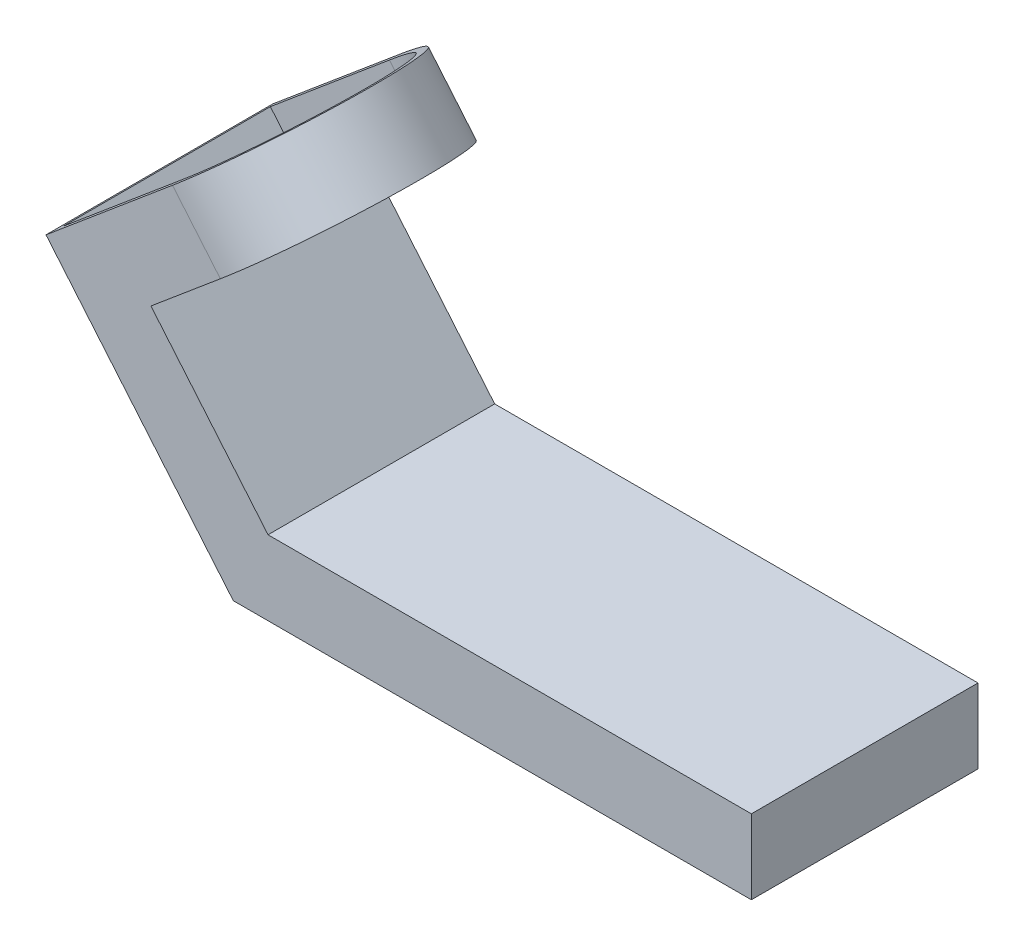
from build123d import *

# Parameters (mm, degrees)
BOSS_EXTRU_1_DEPTH      = 70
BOSS_EXTRU_2_DEPTH      = 23
ENL_V_MAT_EXTRU_1_REACH = 240.982
ESQUISSE3_R             = 9.500000000000002
COQUE1_T                = -3


with BuildPart() as part:
    # Esquisse1 → Boss.-Extru.1 (new body)
    with BuildSketch(Plane.XY):
        Polygon((0, 0), (-57.85088487178843, 68.94399988070812), (-18.782618272720498, 101.72616797472158), (-3.9985032499301187, 84.10714578298506), (-25.447747657261537, 66.10909271176199), (10.725076137565006, 23.000000000000007), (160, 23.000000000000004), (160, 2.45e-15), align=None)
    extrude(amount=-BOSS_EXTRU_1_DEPTH)

    # Esquisse2 → Boss.-Extru.2 (add)
    with BuildSketch(Plane(origin=(-57.85088487178846, 68.94399988070815, 0), x_dir=(0.7660444431189791, 0.6427876096865383, 0), z_dir=(-0.6427876096865383, 0.7660444431189791, 0))):
        with BuildLine():
            Line((51.00000000000002, 70), (50.99999999999999, 0))
            ThreePointArc((50.99999999999999, 0), (86.00000000000003, 34.999999999999986), (51.00000000000002, 70))
        make_face()
    extrude(amount=-BOSS_EXTRU_2_DEPTH)

    # Esquisse3 → Enlèv. mat.-Extru.1 (cut, up to next)
    with BuildSketch(Plane(origin=(-57.85088487178846, 68.94399988070815, 0), x_dir=(0.7660444431189791, 0.6427876096865383, 0), z_dir=(-0.6427876096865383, 0.7660444431189791, 0)), mode=Mode.PRIVATE) as enl_v_mat_extru_1_sk1:
        with Locations(Location((51.000000000000036, 35, 0), (0, 0, 180))):
            Circle(ESQUISSE3_R)
    enl_v_mat_extru_1_tool1 = extrude(enl_v_mat_extru_1_sk1.sketch, amount=-ENL_V_MAT_EXTRU_1_REACH, mode=Mode.PRIVATE) & part.part
    add(enl_v_mat_extru_1_tool1.solids().sort_by_distance((-18.782618, 101.726168, -35))[0], mode=Mode.SUBTRACT)

    # Coque1
    coque1_openings = [part.faces().sort_by_distance(p)[0] for p in [
        (-27.96387644, 94.022177633, -35),
        (-4.113138552, 99.023139171, -35),
    ]]
    offset(amount=COQUE1_T, openings=coque1_openings, kind=Kind.INTERSECTION)


solid = part.part
